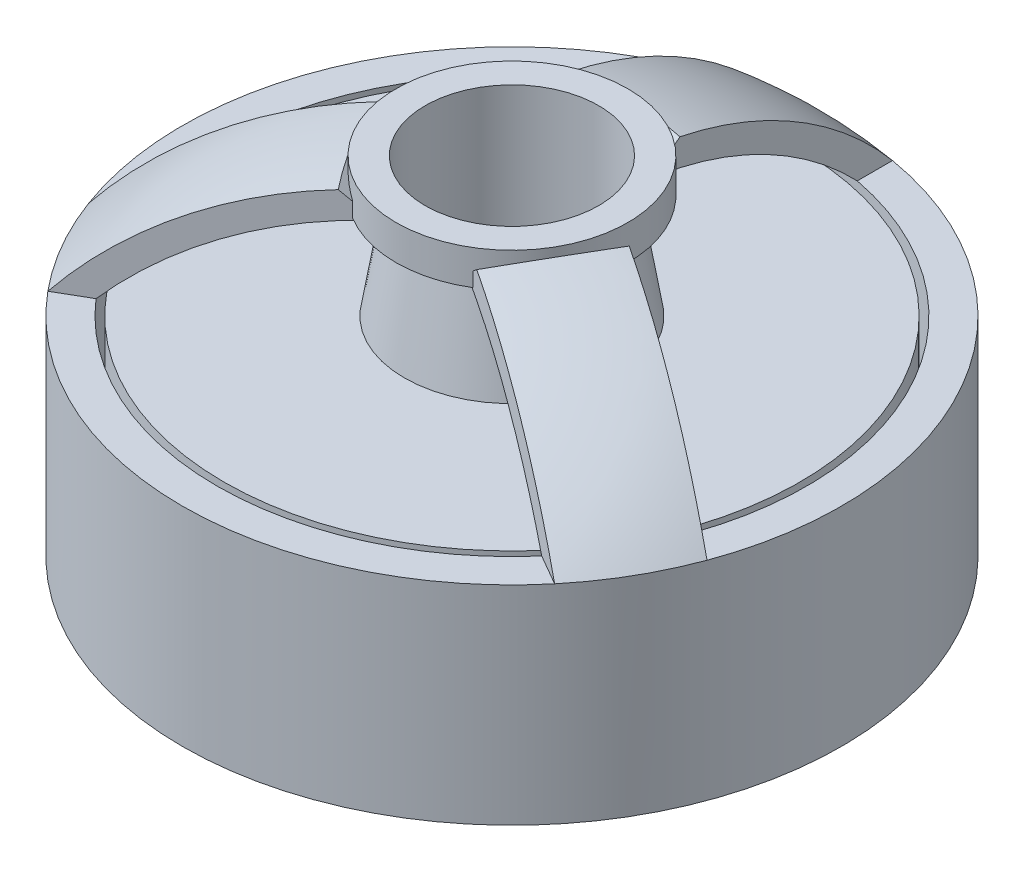
from build123d import *

# Parameters (mm, degrees)
SKETCH1_R           = 47.5
BOSS_EXTRUDE1_DEPTH = 30
SKETCH2_R           = 12.5
CUT_EXTRUDE1_DEPTH  = 30
SKETCH3_R           = 42.5
SKETCH3_R_2         = 41.5
CUT_EXTRUDE3_DEPTH  = 74.569694848
SKETCH6_R           = 13
SKETCH5_R           = 15.5
SKETCH9_R           = 12
CUT_EXTRUDE4_DEPTH  = 81.854808144
CIRPATTERN1_COUNT   = 3
SKETCH18_R          = 16.711627315
BOSS_EXTRUDE3_DEPTH = 5
SKETCH19_R          = 12.5
CUT_EXTRUDE5_DEPTH  = 84.740671179


with BuildPart() as part:
    # Sketch1 → Boss-Extrude1 (new body)
    with BuildSketch(Plane(origin=(0, 0, 0), x_dir=(1, 0, 0), z_dir=(0, 1, 0))):
        with Locations(Location((0, 0, 0), (0, 0, 270))):
            Circle(SKETCH1_R)
    extrude(amount=BOSS_EXTRUDE1_DEPTH)

    # Sketch2 → Cut-Extrude1 (cut)
    with BuildSketch(Plane(origin=(0, 30, 0), x_dir=(1, 0, 0), z_dir=(0, 1, 0))):
        with Locations(Location((0, 0, 0), (0, 0, 270))):
            Circle(SKETCH2_R)
    extrude(amount=-CUT_EXTRUDE1_DEPTH, mode=Mode.SUBTRACT)

    # Sketch3 → Cut-Extrude3 (cut, through all)
    with BuildSketch(Plane(origin=(0, 30, 0), x_dir=(1, 0, 0), z_dir=(0, 1, 0))):
        with Locations(Location((0, 0, 0), (0, 0, 270))):
            Circle(SKETCH3_R)
        with Locations(Location((0, 0, 0), (0, 0, 270))):
            Circle(SKETCH3_R_2, mode=Mode.SUBTRACT)
    extrude(amount=-CUT_EXTRUDE3_DEPTH, mode=Mode.SUBTRACT)


with BuildPart() as cut_extrude3_piece_1:
    # of the separate pieces the step leaves, piece 1, a body of its own (cut_extrude3_pieces)
    add(part.part.solids().sort_by_distance((0, 0, 41.5))[0])

    # Sketch6 → Loft1 section 0
    with BuildSketch(Plane(origin=(0, 45, 0), x_dir=(-1, 0, 0), z_dir=(0, -1, 0))):
        Circle(SKETCH6_R)
    # Sketch5 → Loft1 section 1
    with BuildSketch(Plane(origin=(0, 30, 0), x_dir=(1, 0, 0), z_dir=(0, 1, 0))):
        Circle(SKETCH5_R)
    loft()

    # Sketch9 → Cut-Extrude4 (cut, through all)
    with BuildSketch(Plane(origin=(0, 45, 0), x_dir=(1, 0, 0), z_dir=(0, 1, 0))):
        with Locations(Location((0, 0, 0), (0, 0, 270))):
            Circle(SKETCH9_R)
    extrude(amount=-CUT_EXTRUDE4_DEPTH, mode=Mode.SUBTRACT)



with BuildPart() as cut_extrude3_piece_2:
    # of the separate pieces the step leaves, piece 2, a body of its own (cut_extrude3_pieces)
    add(part.part.solids().sort_by_distance((0, 0, 47.5))[0])

    # Sweep1: sweep along a path in Sketch13
    with BuildLine(Plane(origin=(0, 0, 0), x_dir=(0, 0, -1), z_dir=(1, 0, 0))) as sweep1_path:
        ThreePointArc((12, 45), (28.013623807, 39.985126821), (41.5, 30))
    # Sketch10 → Sweep1 (sweep)
    with BuildSketch(Plane(origin=(0, 30, 0), x_dir=(1, 0, 0), z_dir=(0, 1, 0))):
        with BuildLine():
            Line((8.039798927, 41.732620733), (8.039798927, 46.814651907))
            ThreePointArc((8.039798927, 46.814651907), (0, 47.5), (-8.039798927, 46.814651907))
            Line((-8.039798927, 46.814651907), (-8.039798927, 41.732620733))
            ThreePointArc((-8.039798927, 41.732620733), (0, 42.5), (8.039798927, 41.732620733))
        make_face()
    sweep1 = sweep(path=sweep1_path.line)

    # CirPattern1: Sweep1 ×3 about axis
    cirpattern1_axis = Axis((0, 30, 0), (0, 1, 0))
    for i in range(1, CIRPATTERN1_COUNT):
        add(sweep1.rotate(cirpattern1_axis, i * 360 / CIRPATTERN1_COUNT))


with BuildPart() as cut_extrude3_piece_1_1:
    add(cut_extrude3_piece_1.part)

    add(cut_extrude3_piece_2.part)  # Boss-Extrude3 merges Cut-Extrude3 piece 2
    # Sketch18 → Boss-Extrude3 (add)
    with BuildSketch(Plane(origin=(0, 50, 0), x_dir=(-1, 0, 0), z_dir=(0, -1, 0))):
        with Locations(Location((0, 0, 0), (0, 0, 90))):
            Circle(SKETCH18_R)
    extrude(amount=BOSS_EXTRUDE3_DEPTH)

    # Sketch19 → Cut-Extrude5 (cut, through all)
    with BuildSketch(Plane(origin=(0, 50, 0), x_dir=(1, 0, 0), z_dir=(0, 1, 0))):
        with Locations(Location((0, 0, 0), (0, 0, 270))):
            Circle(SKETCH19_R)
    extrude(amount=-CUT_EXTRUDE5_DEPTH, mode=Mode.SUBTRACT)


solid = cut_extrude3_piece_1_1.part
